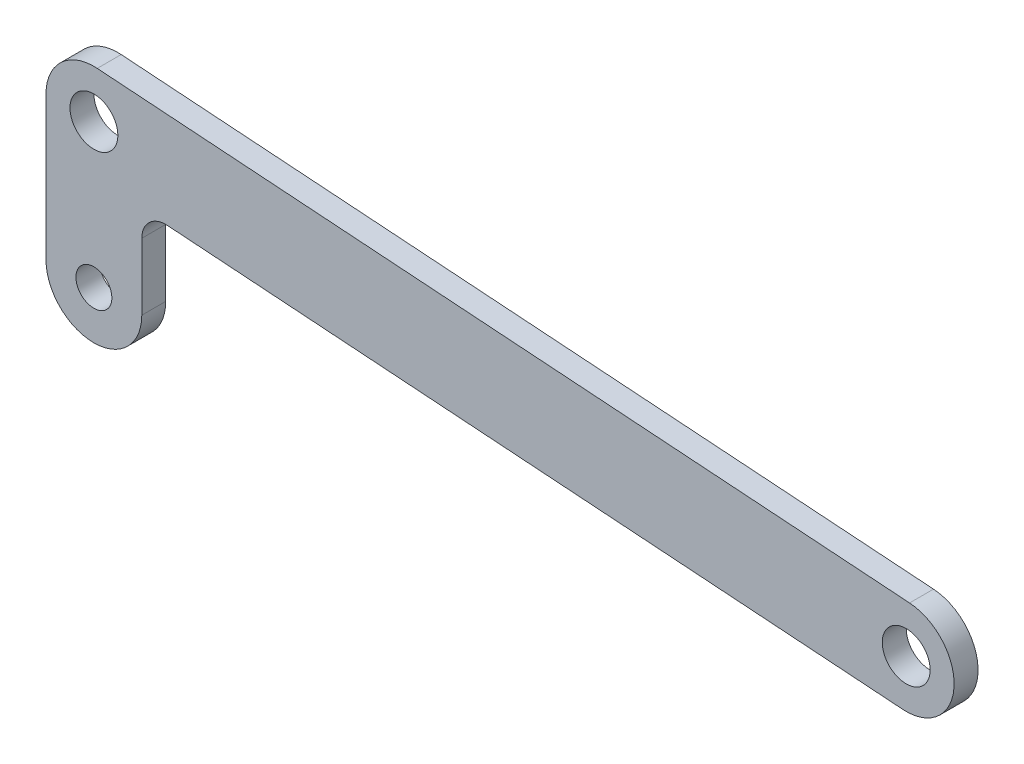
from build123d import *

# Parameters (mm, degrees)
CROQUIS1_R              = 7.5
CROQUIS1_R_2            = 10
SALIENTE_EXTRUIR1_DEPTH = 10


with BuildPart() as part:
    # Croquis1 → Saliente-Extruir1 (new body)
    with BuildSketch(Plane.XY):
        with BuildLine():
            Line((-20, 0), (-20, 60))
            ThreePointArc((-20, 60), (-13.639967201, 74.627074032), (1.395129475, 79.951281005))
            Line((1.395129475, 79.951281005), (340.566906563, 56.234079932))
            ThreePointArc((340.566906563, 56.234079932), (359.123058094, 34.887669452), (337.776647613, 16.331517922))
            Line((337.776647613, 16.331517922), (30.697564737, 37.804579202))
            ThreePointArc((30.697564737, 37.804579202), (23.180016399, 35.142475715), (20, 27.828938699))
            Line((20, 27.828938699), (20, 0))
            ThreePointArc((20, 0), (0, -20), (-20, 0))
        make_face()
        Circle(CROQUIS1_R, mode=Mode.SUBTRACT)
        with Locations((339.171777088, 36.282798927)):
            Circle(CROQUIS1_R_2, mode=Mode.SUBTRACT)
        with Locations((0, 60)):
            Circle(CROQUIS1_R_2, mode=Mode.SUBTRACT)
    extrude(amount=SALIENTE_EXTRUIR1_DEPTH)


solid = part.part
